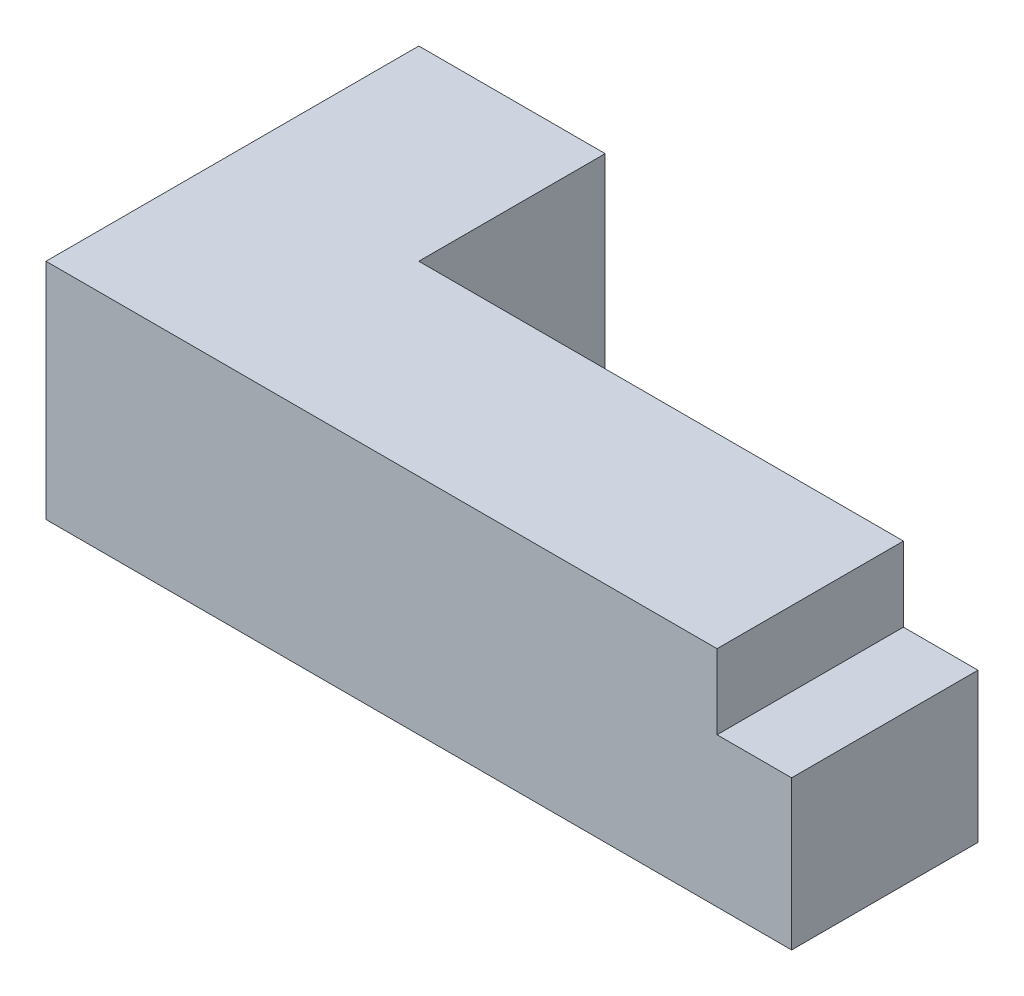
from build123d import *

# Parameters (mm, degrees)
P_IDAT_VYSUNUT_M1_DEPTH  = 30
ODEBRAT_VYSUNUT_M1_REACH = 117.758
SKICA2_W                 = 10
SKICA2_H                 = 10


with BuildPart() as part:
    # Skica1 → Přidat vysunutím1 (new body)
    with BuildSketch(Plane(origin=(0, 0, 0), x_dir=(1, 0, 0), z_dir=(0, 1, 0))):
        Polygon((100, 25), (100, 0), (0, 0), (0, 50), (25, 50), (25, 25), align=None)
    extrude(amount=P_IDAT_VYSUNUT_M1_DEPTH)

    # Skica2 → Odebrat vysunutím1 (cut, up to next)
    with BuildSketch(Plane.XY, mode=Mode.PRIVATE) as odebrat_vysunut_m1_sk1:
        with Locations((95, 25)):
            Rectangle(SKICA2_W, SKICA2_H)
    odebrat_vysunut_m1_tool1 = extrude(odebrat_vysunut_m1_sk1.sketch, amount=-ODEBRAT_VYSUNUT_M1_REACH, mode=Mode.PRIVATE) & part.part
    add(odebrat_vysunut_m1_tool1.solids().sort_by_distance((95, 25, 0))[0], mode=Mode.SUBTRACT)


solid = part.part
